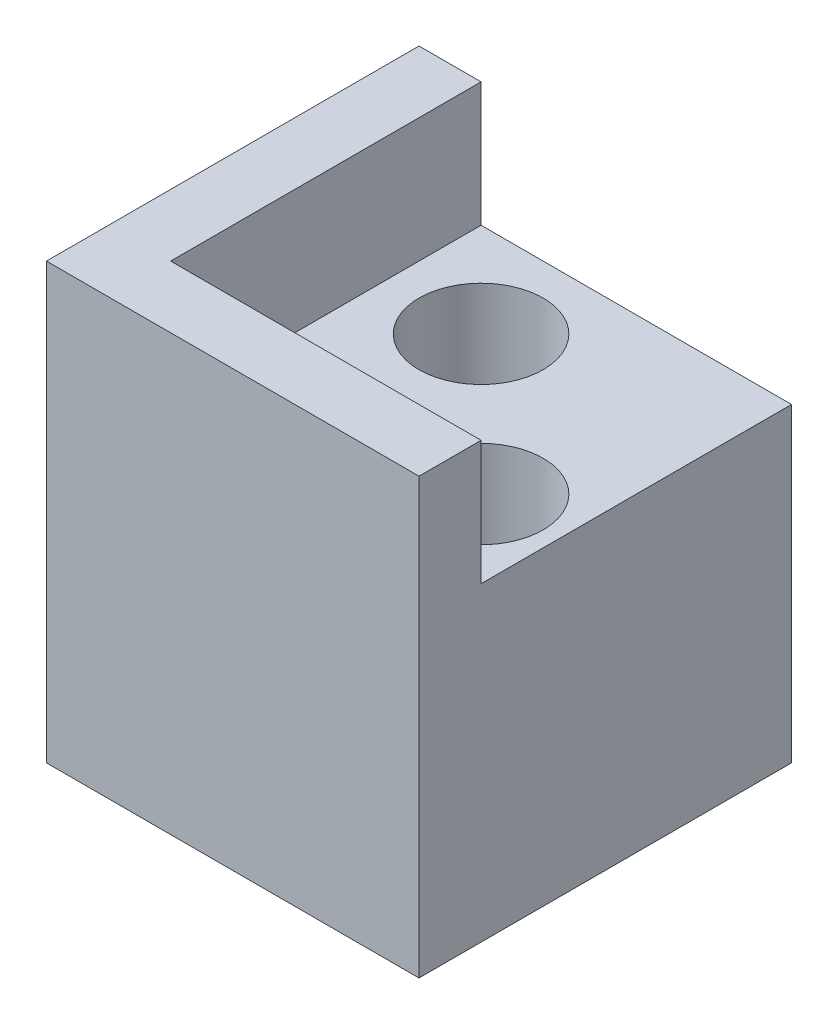
from build123d import *

# Parameters (mm, degrees)
SKETCH1_W           = 30
SKETCH1_H           = 30
BOSS_EXTRUDE2_DEPTH = 35
SKETCH2_W           = 25
SKETCH2_H           = 25
CUT_EXTRUDE1_DEPTH  = 10
SKETCH3_R           = 5
SKETCH3_R_2         = 2
CUT_EXTRUDE4_DEPTH  = 20
SKETCH5_R           = 2
CUT_EXTRUDE5_DEPTH  = 25


with BuildPart() as part:
    # Sketch1 → Boss-Extrude2 (new body)
    with BuildSketch(Plane(origin=(0, 0, 0), x_dir=(1, 0, 0), z_dir=(0, 1, 0))):
        Rectangle(SKETCH1_W, SKETCH1_H)
    extrude(amount=BOSS_EXTRUDE2_DEPTH)

    # Sketch2 → Cut-Extrude1 (cut)
    with BuildSketch(Plane(origin=(0, 35, 0), x_dir=(1, 0, 0), z_dir=(0, 1, 0))):
        with Locations((2.5, 2.5)):
            Rectangle(SKETCH2_W, SKETCH2_H)
    extrude(amount=-CUT_EXTRUDE1_DEPTH, mode=Mode.SUBTRACT)

    # Sketch3 → Cut-Extrude4 (cut)
    # profile 1 of 2: a face of its own
    with BuildSketch(Plane(origin=(0, 25, 0), x_dir=(1, 0, 0), z_dir=(0, 1, 0))):
        with Locations(Location((-2.422862762, 7.422862762, 0), (0, 0, 270))):
            Circle(SKETCH3_R)
        with Locations(Location((-2.422862762, 7.422862762, 0), (0, 0, 270))):
            Circle(SKETCH3_R_2, mode=Mode.SUBTRACT)
    # profile 2 of 2: a face of its own
    with BuildSketch(Plane(origin=(0, 25, 0), x_dir=(1, 0, 0), z_dir=(0, 1, 0))):
        with Locations(Location((8.75, -3.75, 0), (0, 0, 270))):
            Circle(SKETCH3_R)
        with Locations(Location((8.75, -3.75, 0), (0, 0, 270))):
            Circle(SKETCH3_R_2, mode=Mode.SUBTRACT)
    extrude(amount=-CUT_EXTRUDE4_DEPTH, mode=Mode.SUBTRACT)

    # Sketch5 → Cut-Extrude5 (cut)
    with BuildSketch(Plane(origin=(0, 25, 0), x_dir=(1, 0, 0), z_dir=(0, 1, 0))):
        with Locations(Location((-2.422862762, 7.422862762, 0), (0, 0, 270))):
            Circle(SKETCH5_R)
        with Locations(Location((8.75, -3.75, 0), (0, 0, 270))):
            Circle(SKETCH5_R)
    extrude(amount=-CUT_EXTRUDE5_DEPTH, mode=Mode.SUBTRACT)


solid = part.part
